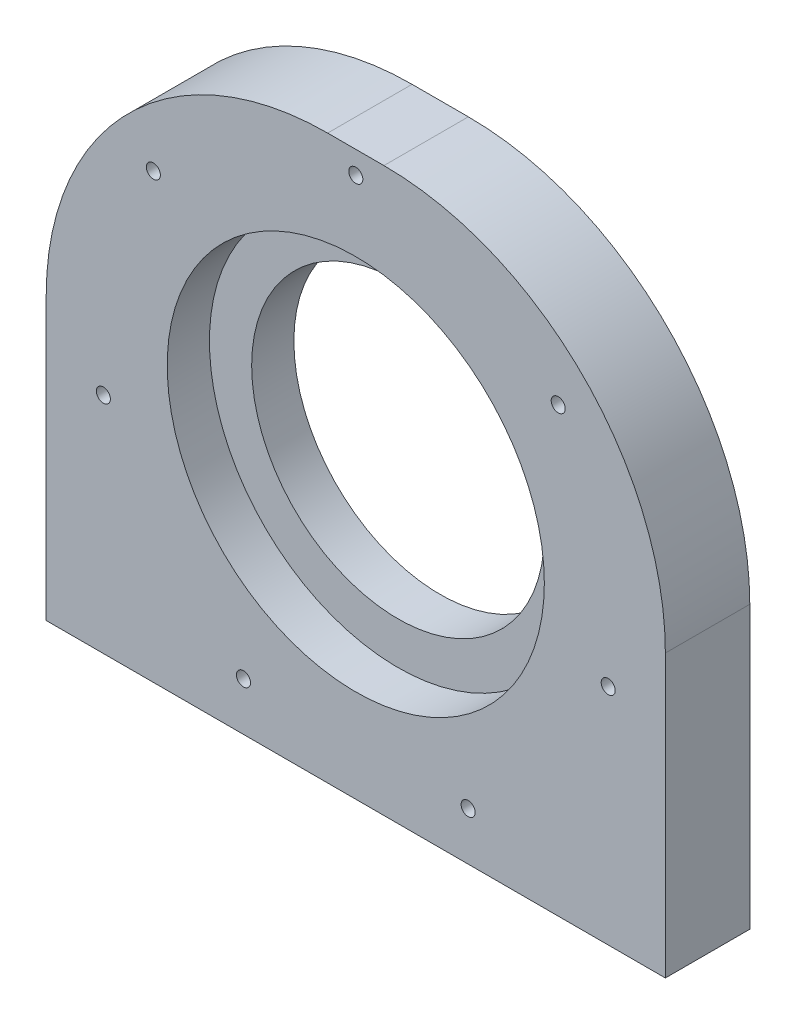
from build123d import *

# Parameters (mm, degrees)
SKIZZE1_W                       = 110
SKIZZE1_H                       = 100
AUFSATZ_LINEAR_AUSTRAGEN1_DEPTH = 15
SKIZZE2_R                       = 33.5
SCHNITT_LINEAR_AUSTRAGEN1_DEPTH = 7.5
SKIZZE3_R                       = 26
SCHNITT_LINEAR_AUSTRAGEN2_DEPTH = 7.5
SKIZZE4_R                       = 2.1
SCHNITT_LINEAR_AUSTRAGEN3_DEPTH = 10
SKIZZE5_R                       = 1.25
SCHNITT_LINEAR_AUSTRAGEN5_DEPTH = 10
VERRUNDUNG1_R                   = 50


with BuildPart() as part:
    # Skizze1 → Aufsatz-Linear austragen1 (new body)
    with BuildSketch(Plane.XY):
        with Locations((55, 50)):
            Rectangle(SKIZZE1_W, SKIZZE1_H)
    extrude(amount=AUFSATZ_LINEAR_AUSTRAGEN1_DEPTH)

    # Skizze2 → Schnitt-Linear austragen1 (cut)
    with BuildSketch(Plane.XY.offset(15)):
        with Locations((55, 50)):
            Circle(SKIZZE2_R)
    extrude(amount=-SCHNITT_LINEAR_AUSTRAGEN1_DEPTH, mode=Mode.SUBTRACT)

    # Skizze3 → Schnitt-Linear austragen2 (cut)
    with BuildSketch(Plane(origin=(0, 0, 0), x_dir=(-1, 0, 0), z_dir=(0, 0, -1))):
        with Locations((-55, 50)):
            Circle(SKIZZE3_R)
    extrude(amount=-SCHNITT_LINEAR_AUSTRAGEN2_DEPTH, mode=Mode.SUBTRACT)

    # Skizze4 → Schnitt-Linear austragen3 (cut)
    with BuildSketch(Plane.XZ):
        with Locations(Location((25, 7.5, 0), (0, 0, 270))):
            Circle(SKIZZE4_R)
        with Locations(Location((85, 7.5, 0), (0, 0, 270))):
            Circle(SKIZZE4_R)
        with Locations(Location((55, 7.5, 0), (0, 0, 270))):
            Circle(SKIZZE4_R)
    extrude(amount=-SCHNITT_LINEAR_AUSTRAGEN3_DEPTH, mode=Mode.SUBTRACT)

    # Skizze5 → Schnitt-Linear austragen5 (cut)
    with BuildSketch(Plane.XY.offset(15)):
        with Locations((55, 96)):
            Circle(SKIZZE5_R)
        with Locations((90.964248194, 78.680530886)):
            Circle(SKIZZE5_R)
        with Locations((99.84668396, 39.764037038)):
            Circle(SKIZZE5_R)
        with Locations((74.958651999, 8.555432076)):
            Circle(SKIZZE5_R)
        with Locations((35.041348001, 8.555432076)):
            Circle(SKIZZE5_R)
        with Locations((10.15331604, 39.764037038)):
            Circle(SKIZZE5_R)
        with Locations((19.035751806, 78.680530886)):
            Circle(SKIZZE5_R)
    extrude(amount=-SCHNITT_LINEAR_AUSTRAGEN5_DEPTH, mode=Mode.SUBTRACT)

    # Verrundung1
    verrundung1_edges = [part.edges().sort_by_distance(p)[0] for p in [
        (0, 100, 7.5),
        (110, 100, 7.5),
    ]]
    fillet(verrundung1_edges, radius=VERRUNDUNG1_R)


solid = part.part
